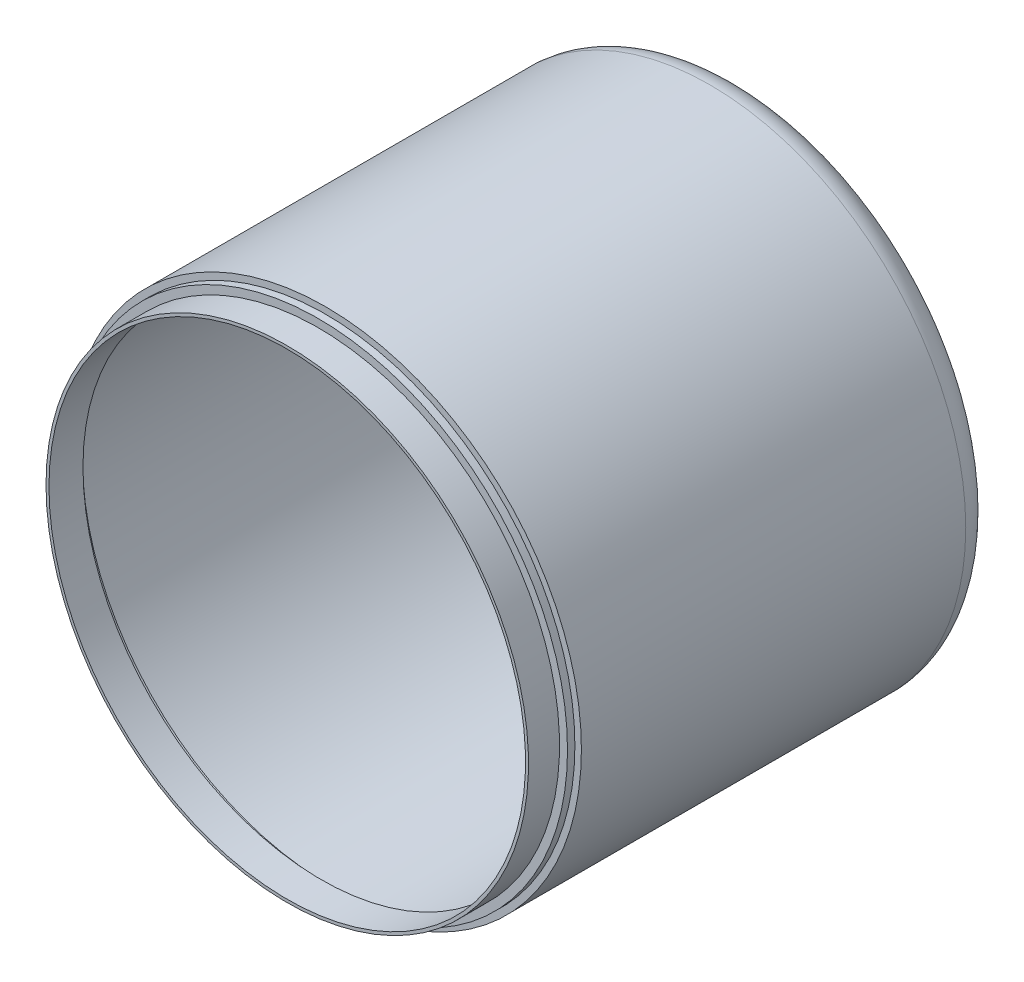
from build123d import *

# Parameters (mm, degrees)
SCHIZZO1_R                   = 70
ESTRUSIONE_ESTRUSIONE1_DEPTH = 2.2
SCHIZZO2_R                   = 86.5
ESTRUSIONE_ESTRUSIONE2_DEPTH = 140
SCHIZZO3_R                   = 84.3
ESTRUSIONE_ESTRUSIONE3_DEPTH = 2.5
SCHIZZO4_R                   = 81.6
ESTRUSIONE_ESTRUSIONE4_DEPTH = 10.5
SVUOTA1_T                    = -1
RACCORDO1_R                  = 10


with BuildPart() as part:
    # Schizzo1 → Estrusione-Estrusione1 (new body)
    with BuildSketch(Plane.XY):
        Circle(SCHIZZO1_R)
    extrude(amount=ESTRUSIONE_ESTRUSIONE1_DEPTH)

    # Schizzo2 → Estrusione-Estrusione2 (add)
    with BuildSketch(Plane.XY.offset(2.2)):
        Circle(SCHIZZO2_R)
    extrude(amount=ESTRUSIONE_ESTRUSIONE2_DEPTH)

    # Schizzo3 → Estrusione-Estrusione3 (add)
    with BuildSketch(Plane.XY.offset(142.2)):
        Circle(SCHIZZO3_R)
    extrude(amount=ESTRUSIONE_ESTRUSIONE3_DEPTH)

    # Schizzo4 → Estrusione-Estrusione4 (add)
    with BuildSketch(Plane.XY.offset(144.7)):
        with Locations(Location((0, 0, 0), (0, 0, 180))):
            Circle(SCHIZZO4_R)
    extrude(amount=ESTRUSIONE_ESTRUSIONE4_DEPTH)

    # Svuota1
    svuota1_openings = [part.faces().sort_by_distance(p)[0] for p in [
        (0, 0, 155.2),
    ]]
    offset(amount=SVUOTA1_T, openings=svuota1_openings, kind=Kind.INTERSECTION)

    # Raccordo1
    raccordo1_edges = [part.edges().sort_by_distance(p)[0] for p in [
        (-85.5, 0, 3.2),
        (-86.5, 0, 2.2),
    ]]
    fillet(raccordo1_edges, radius=RACCORDO1_R)


solid = part.part
